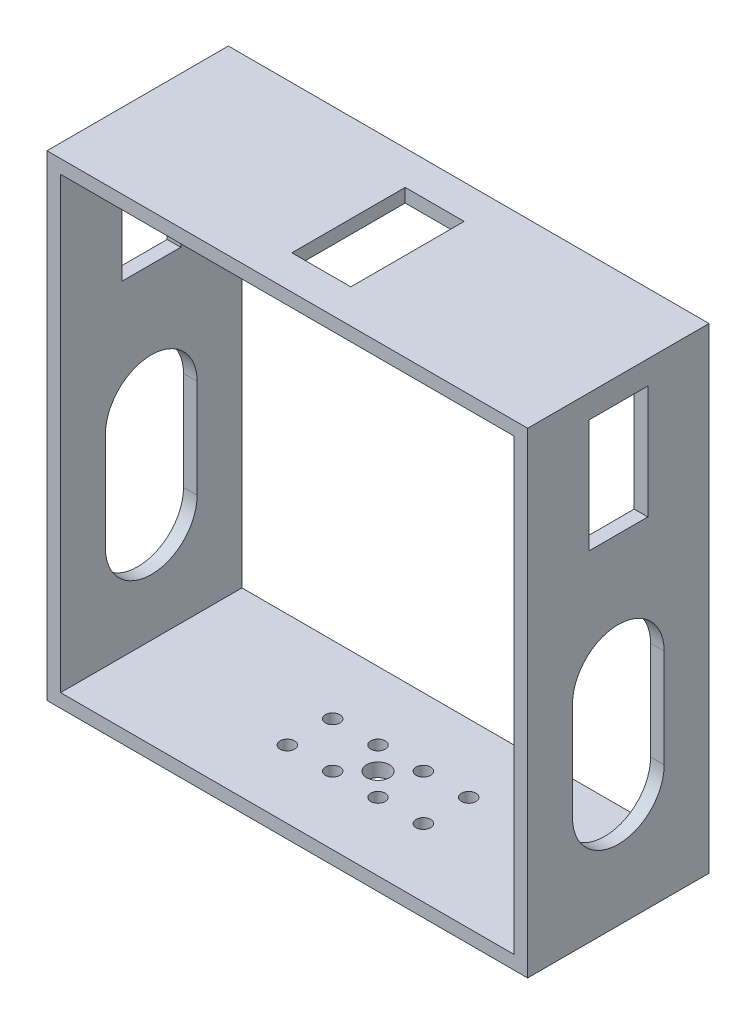
from build123d import *

# Parameters (mm, degrees)
SKETCH_1_W                      = 106
SKETCH_1_H                      = 105
EXTRUDE_1_DEPTH                 = 40
CUT_EXTRUDE_1_DEPTH             = 125.233650836
CUT_EXTRUDE_1_DEPTH_BACK        = 125.233650836
SKETCH_3_W                      = 100
SKETCH_3_H                      = 99
CUT_EXTRUDE_3_DEPTH             = 1
CUT_EXTRUDE_3_DEPTH_BACK        = 3
SKETCH_7_R                      = 2.5
SKETCH_7_R_2                    = 1.6
CUT_EXTRUDE_4_REACH             = 126.234
SKETCH_6_W                      = 13
SKETCH_6_H                      = 25
CUT_EXTRUDE_4_DIRECTION_2_DEPTH = 125.233650836
CUT_EXTRUDE_5_DEPTH             = 155.470061824
CUT_EXTRUDE_5_DEPTH_BACK        = 155.470061824
SKETCH_10_W                     = 13
SKETCH_10_H                     = 25
CUT_EXTRUDE_6_DEPTH             = 155.470061824
CUT_EXTRUDE_6_DEPTH_BACK        = 155.470061824


with BuildPart() as part:
    # 草图1 → 凸台-拉伸1 (new body)
    with BuildSketch(Plane.XY):
        with Locations((0, 52.5)):
            Rectangle(SKETCH_1_W, SKETCH_1_H)
    extrude(amount=EXTRUDE_1_DEPTH)

    # 草图3 → 切除-拉伸1 (cut, two sides: drawn at the far end of the back side and taken through both)
    with BuildSketch(Plane(origin=(0, 0, 0), x_dir=(-1, 0, 0), z_dir=(0, 0, -1)).offset(-CUT_EXTRUDE_1_DEPTH_BACK)):
        with Locations((0, 52.5)):
            Rectangle(SKETCH_3_W, SKETCH_3_H)
    extrude(amount=CUT_EXTRUDE_1_DEPTH + CUT_EXTRUDE_1_DEPTH_BACK, mode=Mode.SUBTRACT)

    # 草图7 → 切除-拉伸3 (cut, two sides: drawn at the far end of the back side and taken through both)
    with BuildSketch(Plane.XZ.offset(-CUT_EXTRUDE_3_DEPTH_BACK)):
        with Locations(Location((0, 20, 0), (0, 0, 180))):
            Circle(SKETCH_7_R)
        with Locations(Location((5, 25, 0), (0, 0, 180))):
            Circle(SKETCH_7_R_2)
        with Locations(Location((5, 15, 0), (0, 0, 180))):
            Circle(SKETCH_7_R_2)
        with Locations(Location((-5, 15, 0), (0, 0, 180))):
            Circle(SKETCH_7_R_2)
        with Locations(Location((-5, 25, 0), (0, 0, 180))):
            Circle(SKETCH_7_R_2)
        with Locations(Location((15, 25, 0), (0, 0, 180))):
            Circle(SKETCH_7_R_2)
        with Locations(Location((-15, 25, 0), (0, 0, 180))):
            Circle(SKETCH_7_R_2)
        with Locations(Location((15, 15, 0), (0, 0, 180))):
            Circle(SKETCH_7_R_2)
        with Locations(Location((-15, 15, 0), (0, 0, 180))):
            Circle(SKETCH_7_R_2)
    extrude(amount=CUT_EXTRUDE_3_DEPTH + CUT_EXTRUDE_3_DEPTH_BACK, mode=Mode.SUBTRACT)

    # 草图6 → 切除-拉伸4 (cut, up to next)
    with BuildSketch(Plane(origin=(0, 105, 0), x_dir=(1, 0, 0), z_dir=(0, 1, 0)), mode=Mode.PRIVATE) as cut_extrude_4_sk1:
        with Locations((0, -20)):
            Rectangle(SKETCH_6_W, SKETCH_6_H)
    cut_extrude_4_tool1 = extrude(cut_extrude_4_sk1.sketch, amount=-CUT_EXTRUDE_4_REACH, mode=Mode.PRIVATE) & part.part
    add(cut_extrude_4_tool1.solids().sort_by_distance((0, 105, 20))[0], mode=Mode.SUBTRACT)

    # 草图6 → 切除-拉伸4 direction 2 (cut)
    with BuildSketch(Plane(origin=(0, 105, 0), x_dir=(1, 0, 0), z_dir=(0, 1, 0))):
        with Locations((0, -20)):
            Rectangle(SKETCH_6_W, SKETCH_6_H)
    extrude(amount=CUT_EXTRUDE_4_DIRECTION_2_DEPTH, mode=Mode.SUBTRACT)

    # 草图10 → 切除-拉伸5 (cut, two sides: drawn at the far end of the back side and taken through both)
    with BuildSketch(Plane.ZY.offset(53).offset(-CUT_EXTRUDE_5_DEPTH_BACK)):
        with Locations((20, 87.306952357)):
            Rectangle(SKETCH_10_W, SKETCH_10_H)
    extrude(amount=CUT_EXTRUDE_5_DEPTH + CUT_EXTRUDE_5_DEPTH_BACK, mode=Mode.SUBTRACT)

    # 草图12 → 切除-拉伸6 (cut, two sides: drawn at the far end of the back side and taken through both)
    with BuildSketch(Plane(origin=(53, 0, 0), x_dir=(0, 0, -1), z_dir=(1, 0, 0)).offset(-CUT_EXTRUDE_6_DEPTH_BACK)):
        with BuildLine():
            Line((-30.108588081, 25.649961527), (-30.108588081, 47.398469004))
            ThreePointArc((-30.108588081, 47.398469004), (-20, 57.507057086), (-9.891411919, 47.398469004))
            Line((-9.891411919, 47.398469004), (-9.891411919, 25.649961527))
            ThreePointArc((-9.891411919, 25.649961527), (-20, 15.541373446), (-30.108588081, 25.649961527))
        make_face()
    extrude(amount=CUT_EXTRUDE_6_DEPTH + CUT_EXTRUDE_6_DEPTH_BACK, mode=Mode.SUBTRACT)


solid = part.part
